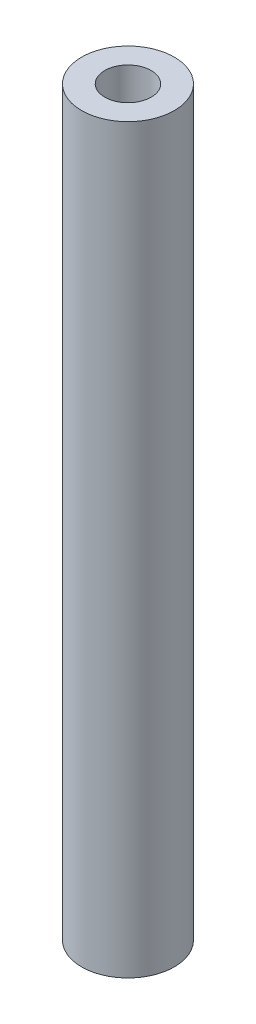
from build123d import *

# Parameters (mm, degrees)
SKETCH_1_R      = 2.5
SKETCH_1_R_2    = 1.25
EXTRUDE_1_DEPTH = 40


with BuildPart() as part:
    # 草图1 → 凸台-拉伸1 (new body)
    with BuildSketch(Plane(origin=(0, 0, 0), x_dir=(1, 0, 0), z_dir=(0, 1, 0))):
        with Locations(Location((0, 0, 0), (0, 0, 270))):
            Circle(SKETCH_1_R)
        with Locations(Location((0, 0, 0), (0, 0, 270))):
            Circle(SKETCH_1_R_2, mode=Mode.SUBTRACT)
    extrude(amount=EXTRUDE_1_DEPTH)


solid = part.part
